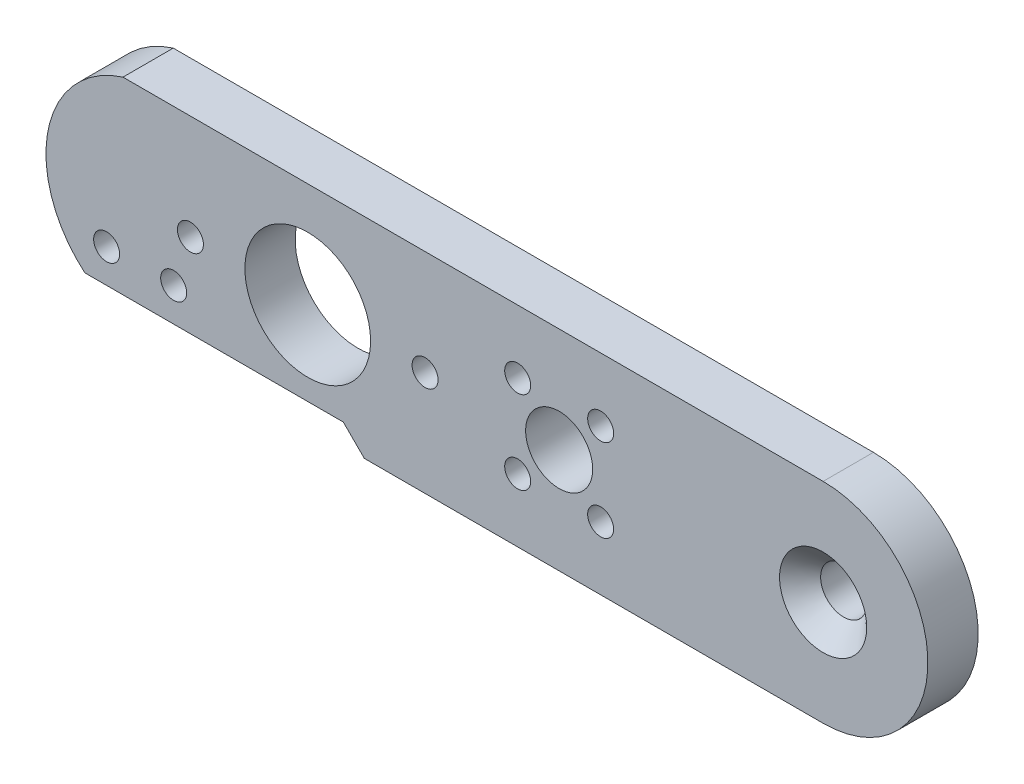
from build123d import *

# Parameters (mm, degrees)
SKETCH1_R                                       = 4
SKETCH1_R_2                                     = 1.55
SKETCH1_R_3                                     = 7.5
BOSS_EXTRUDE1_DEPTH                             = 6
CSK_FOR_M5_FLAT_HEAD_MACHINE_SCREW1_D           = 5.5
CSK_FOR_M5_FLAT_HEAD_MACHINE_SCREW1_DEPTH       = 13.347633298
CSK_FOR_M5_FLAT_HEAD_MACHINE_SCREW1_CSINK_D     = 10.4
CSK_FOR_M5_FLAT_HEAD_MACHINE_SCREW1_CSINK_ANGLE = 90
CSK_FOR_M5_FLAT_HEAD_MACHINE_SCREW1_TIP         = 1.652366702
SKETCH7_R                                       = 1.55
CUT_EXTRUDE1_DEPTH                              = 3
SKETCH8_R                                       = 3
CUT_EXTRUDE2_DEPTH                              = 56.658073272


with BuildPart() as part:
    # Sketch1 → Boss-Extrude1 (new body)
    with BuildSketch(Plane.XY):
        with BuildLine():
            Line((-46.445530028, -10), (-15.598952553, -10))
            Line((-15.598952553, -10), (-13.098952553, -12.5))
            Line((-13.098952553, -12.5), (41.653218929, -12.5))
            ThreePointArc((41.653218929, -12.5), (54.153218929, 0), (41.653218929, 12.5))
            Line((41.653218929, 12.5), (-41.895881711, 12.5))
            ThreePointArc((-41.895881711, 12.5), (-50.825462961, 2.595635751), (-46.445530028, -10))
        make_face()
        with Locations((10.153527864, 0)):
            Circle(SKETCH1_R, mode=Mode.SUBTRACT)
        with Locations((15.103275332, 4.949747468)):
            Circle(SKETCH1_R_2, mode=Mode.SUBTRACT)
        with Locations(Location((5.203780395, 4.949747468, 0), (0, 0, 180))):
            Circle(SKETCH1_R_2, mode=Mode.SUBTRACT)
        with Locations(Location((15.103275332, -4.949747468, 0), (0, 0, 180))):
            Circle(SKETCH1_R_2, mode=Mode.SUBTRACT)
        with Locations((5.203780395, -4.949747468)):
            Circle(SKETCH1_R_2, mode=Mode.SUBTRACT)
        with Locations((-33.846472136, 0)):
            Circle(SKETCH1_R_2, mode=Mode.SUBTRACT)
        with Locations((-19.846472136, 0)):
            Circle(SKETCH1_R_3, mode=Mode.SUBTRACT)
        with Locations((-5.846472136, 0)):
            Circle(SKETCH1_R_2, mode=Mode.SUBTRACT)
    extrude(amount=BOSS_EXTRUDE1_DEPTH)

    # CSK for M5 Flat Head Machine Screw1
    with Locations(Plane.XY.offset(6)):
        with Locations((41.653218929, 0)):
            CounterSinkHole(CSK_FOR_M5_FLAT_HEAD_MACHINE_SCREW1_D / 2, CSK_FOR_M5_FLAT_HEAD_MACHINE_SCREW1_CSINK_D / 2, depth=CSK_FOR_M5_FLAT_HEAD_MACHINE_SCREW1_DEPTH, counter_sink_angle=CSK_FOR_M5_FLAT_HEAD_MACHINE_SCREW1_CSINK_ANGLE)
            with Locations((0, 0, -(CSK_FOR_M5_FLAT_HEAD_MACHINE_SCREW1_DEPTH + CSK_FOR_M5_FLAT_HEAD_MACHINE_SCREW1_TIP / 2))):  # 118° drill point
                Cone(0, CSK_FOR_M5_FLAT_HEAD_MACHINE_SCREW1_D / 2, CSK_FOR_M5_FLAT_HEAD_MACHINE_SCREW1_TIP, mode=Mode.SUBTRACT)

    # Sketch7 → Cut-Extrude1 (cut)
    with BuildSketch(Plane.XY.offset(6)):
        with Locations((-43.846472136, -6)):
            Circle(SKETCH7_R)
        with Locations((-35.846472136, -6)):
            Circle(SKETCH7_R)
    extrude(amount=-CUT_EXTRUDE1_DEPTH, mode=Mode.SUBTRACT)

    # Sketch8 → Cut-Extrude2 (cut, through all)
    with BuildSketch(Plane.XY.offset(3)):
        with Locations((-35.846472136, -6)):
            Circle(SKETCH8_R)
        with Locations((-43.846472136, -6)):
            Circle(SKETCH8_R)
    extrude(amount=-CUT_EXTRUDE2_DEPTH, mode=Mode.SUBTRACT)


solid = part.part
